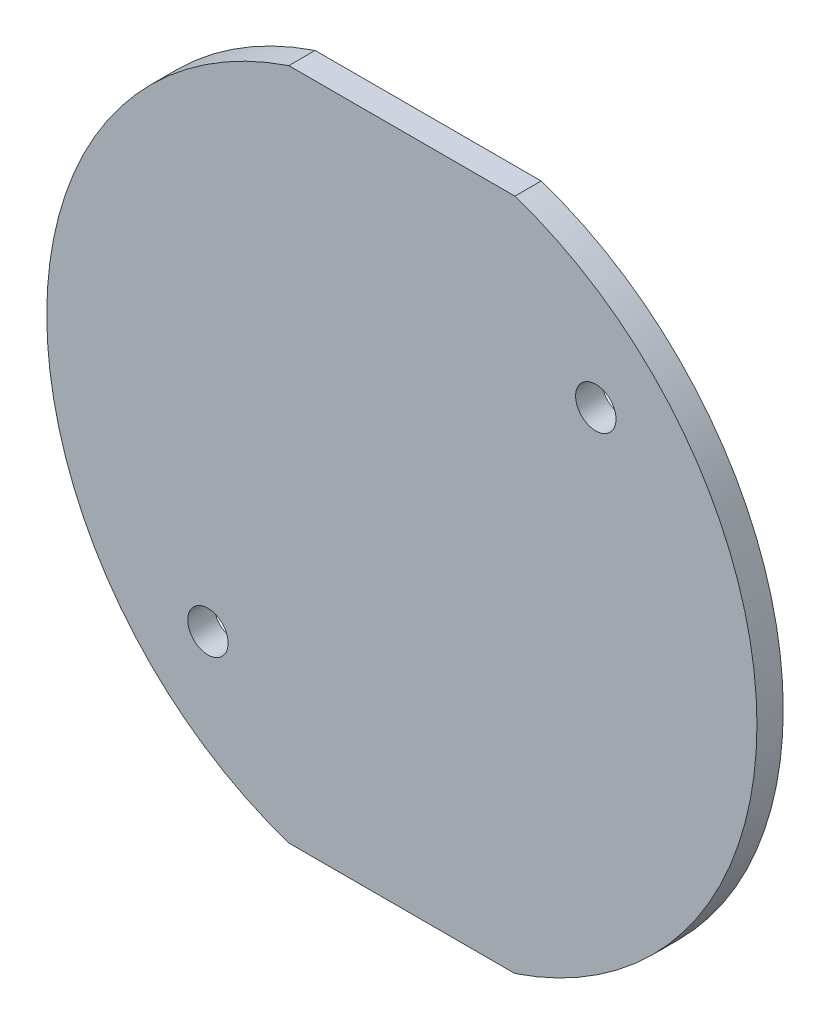
from build123d import *

# Parameters (mm, degrees)
SKETCH1_R           = 21.971
BOSS_EXTRUDE1_DEPTH = 1.6256
SKETCH2_R           = 1.25
CUT_EXTRUDE1_DEPTH  = 32.114180969
SKETCH3_W           = 13.98846053
SKETCH3_H           = 5.196987607
CUT_EXTRUDE2_DEPTH  = 32.114180969


with BuildPart() as part:
    # Sketch1 → Boss-Extrude1 (new body)
    with BuildSketch(Plane.XY):
        Circle(SKETCH1_R)
    extrude(amount=BOSS_EXTRUDE1_DEPTH)

    # Sketch2 → Cut-Extrude1 (cut, through all)
    with BuildSketch(Plane.XY.offset(1.6256)):
        with Locations((12, 12)):
            Circle(SKETCH2_R)
        with Locations((-12, -12)):
            Circle(SKETCH2_R)
    extrude(amount=-CUT_EXTRUDE1_DEPTH, mode=Mode.SUBTRACT)

    # Sketch3 → Cut-Extrude2 (cut, through all)
    with BuildSketch(Plane(origin=(0, 0, 0), x_dir=(-1, 0, 0), z_dir=(0, 0, -1))):
        with Locations((0, 23.426493804)):
            Rectangle(SKETCH3_W, SKETCH3_H)
        with Locations((0, -23.426493804)):
            Rectangle(SKETCH3_W, SKETCH3_H)
    extrude(amount=-CUT_EXTRUDE2_DEPTH, mode=Mode.SUBTRACT)


solid = part.part
